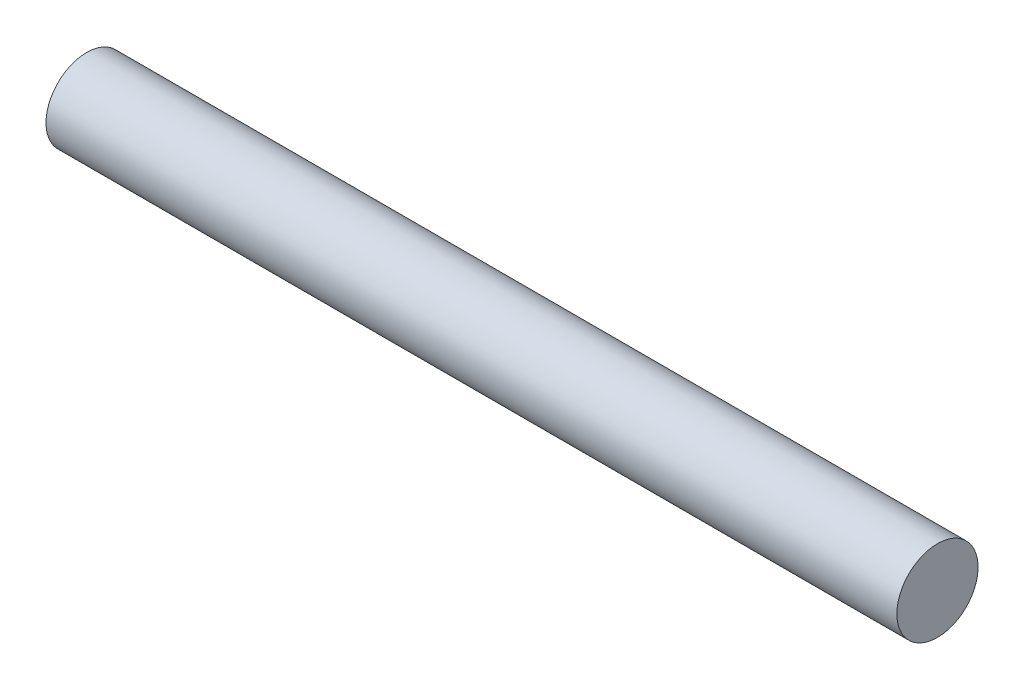
from build123d import *

# Parameters (mm, degrees)
SKETCH1_W = 52.36
SKETCH1_H = 2.5


with BuildPart() as part:
    # Sketch1 → Revolve1 (revolve)
    with BuildSketch(Plane.XY, mode=Mode.PRIVATE) as revolve1_sk:
        with Locations((26.18, 1.25)):
            Rectangle(SKETCH1_W, SKETCH1_H)
    revolve(revolve1_sk.sketch.rotate(Axis((0, 0, 0), (1, 0, 0)), 90), axis=Axis((0, 0, 0), (1, 0, 0)))


solid = part.part
